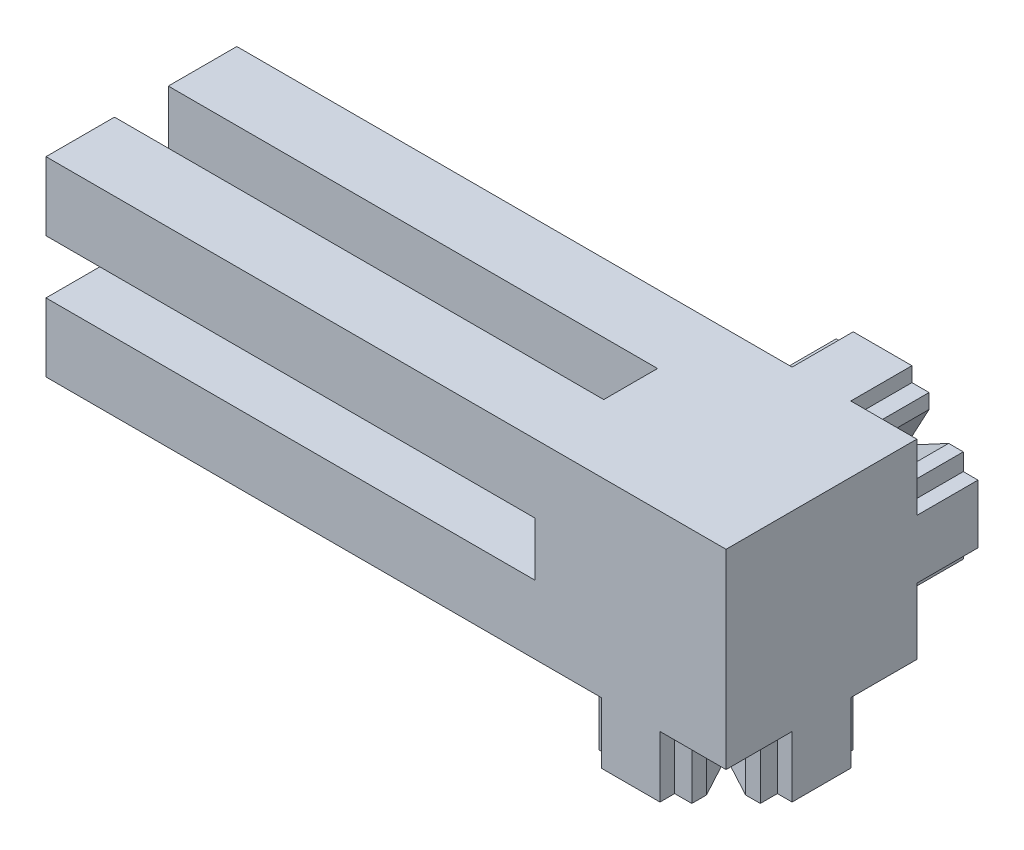
from build123d import *

# Parameters (mm, degrees)
SKETCH1_W           = 19.812
SKETCH1_H           = 19.812
BOSS_EXTRUDE1_DEPTH = 19.812
SKETCH1_3_R         = 2.286
BOSS_EXTRUDE2_DEPTH = 6.35
CUT_EXTRUDE1_DEPTH  = 6.35
SKETCH3_R           = 2.286
BOSS_EXTRUDE3_DEPTH = 6.35
SKETCH4_W           = 7.112
SKETCH4_H           = 7.112
BOSS_EXTRUDE4_DEPTH = 50.8


with BuildPart() as part:
    # Sketch1 → Boss-Extrude1 (new body)
    with BuildSketch(Plane(origin=(0, 0, 0), x_dir=(1, 0, 0), z_dir=(0, 1, 0))):
        with Locations((9.906, -9.906)):
            Rectangle(SKETCH1_W, SKETCH1_H)
    extrude(amount=BOSS_EXTRUDE1_DEPTH)

    # Sketch1<3> → Boss-Extrude2 (add)
    with BuildSketch(Plane(origin=(0, 0, 0), x_dir=(1, 0, 0), z_dir=(0, 1, 0))):
        with Locations((9.906, -9.906)):
            Circle(SKETCH1_3_R)
        Polygon((1.524, -6.858), (0, -6.858), (0, -12.954), (1.524, -12.954), (1.524, -14.732), (3.048, -14.732), (6.35, -12.954), (6.35, -6.858), (3.048, -5.08), (1.524, -5.08), align=None)
        Polygon((19.812, -12.954), (19.812, -6.858), (18.288, -6.858), (18.288, -5.08), (16.764, -5.08), (13.462, -6.858), (13.462, -12.954), (16.764, -14.732), (18.288, -14.732), (18.288, -12.954), align=None)
        Polygon((6.858, -18.288), (6.858, -19.812), (12.954, -19.812), (12.954, -18.288), (14.732, -18.288), (14.732, -16.764), (12.954, -13.462), (6.858, -13.462), (5.08, -16.764), (5.08, -18.288), align=None)
    extrude(amount=-BOSS_EXTRUDE2_DEPTH)

    # Sketch1<5> → Cut-Extrude1 (cut)
    with BuildSketch(Plane(origin=(0, 0, 0), x_dir=(1, 0, 0), z_dir=(0, 1, 0))):
        Polygon((12.954, 0), (6.858, 0), (6.858, -1.524), (5.08, -1.524), (5.08, -3.048), (6.858, -6.35), (9.906, -6.35), (12.954, -6.35), (14.732, -3.048), (14.732, -1.524), (12.954, -1.524), align=None)
    extrude(amount=CUT_EXTRUDE1_DEPTH, mode=Mode.SUBTRACT)

    # Sketch3 → Boss-Extrude3 (add)
    with BuildSketch(Plane(origin=(0, 0, 0), x_dir=(-1, 0, 0), z_dir=(0, 0, -1))):
        Polygon((-19.812, 12.954), (-19.812, 6.858), (-18.288, 6.858), (-18.288, 5.08), (-16.764, 5.08), (-13.462, 6.858), (-13.462, 12.954), (-16.764, 14.732), (-18.288, 14.732), (-18.288, 12.954), align=None)
        with Locations((-9.906, 9.906)):
            Circle(SKETCH3_R)
        Polygon((-6.858, 19.812), (-12.954, 19.812), (-12.954, 18.288), (-14.732, 18.288), (-14.732, 16.764), (-12.954, 13.462), (-6.858, 13.462), (-5.08, 16.764), (-5.08, 18.288), (-6.858, 18.288), align=None)
        Polygon((-6.35, 12.954), (-6.35, 6.858), (-3.048, 5.08), (-1.524, 5.08), (-1.524, 6.858), (0, 6.858), (0, 12.954), (-1.524, 12.954), (-1.524, 14.732), (-3.048, 14.732), align=None)
    extrude(amount=BOSS_EXTRUDE3_DEPTH)

    # Sketch4 → Boss-Extrude4 (add)
    with BuildSketch(Plane.ZY):
        with Locations((16.256, 3.556)):
            Rectangle(SKETCH4_W, SKETCH4_H)
        with Locations((3.556, 16.256)):
            Rectangle(SKETCH4_W, SKETCH4_H)
        with Locations((16.256, 16.256)):
            Rectangle(SKETCH4_W, SKETCH4_H)
        with Locations((3.556, 3.556)):
            Rectangle(SKETCH4_W, SKETCH4_H)
    extrude(amount=BOSS_EXTRUDE4_DEPTH)


solid = part.part
